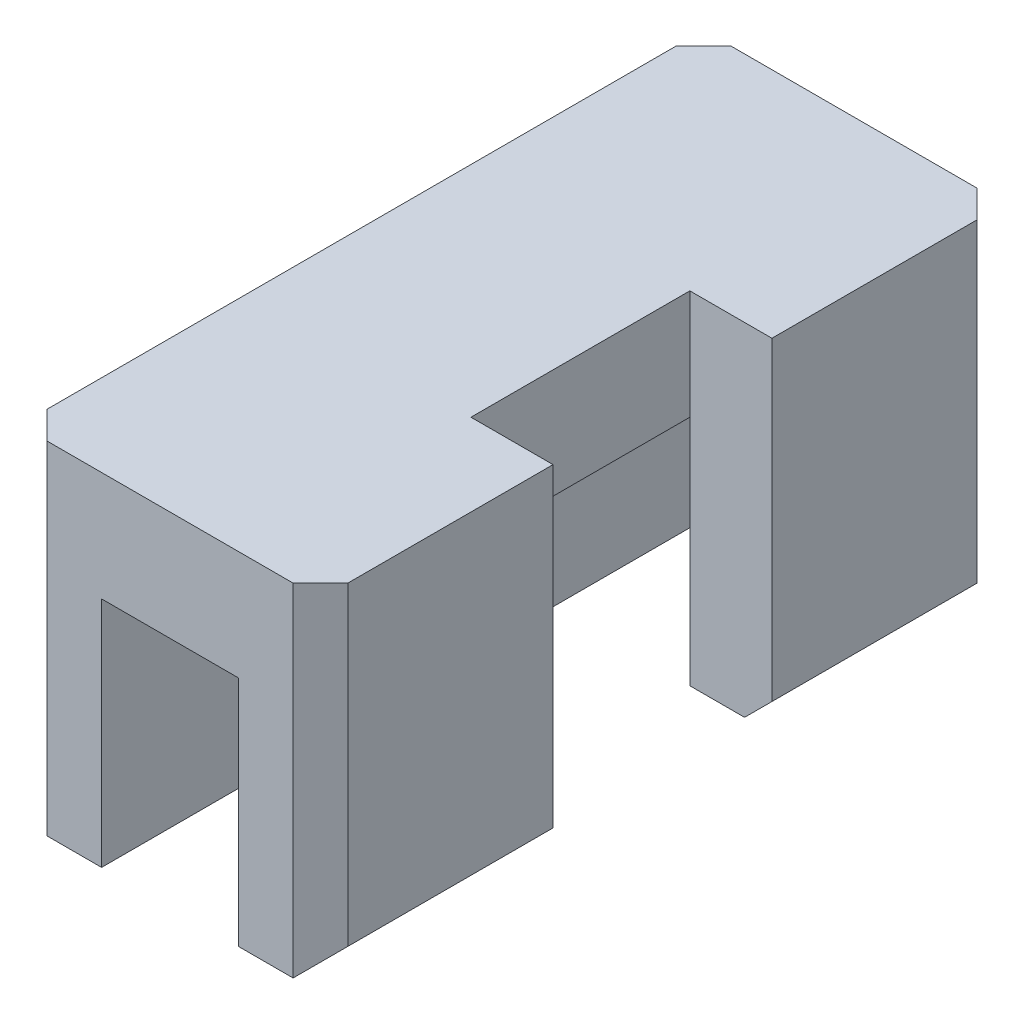
from build123d import *

# Parameters (mm, degrees)
ESTRUSIONE_ESTRUSIONE1_DEPTH = 50
SCHIZZO2_W                   = 16
SCHIZZO2_H                   = 25
TAGLIO_ESTRUSIONE1_DEPTH     = 6
SCHIZZO3_R                   = 2.25
TAGLIO_ESTRUSIONE2_DEPTH     = 10
SMUSSO1_SIZE                 = 2


with BuildPart() as part:
    # Schizzo1 → Estrusione-Estrusione1 (new body)
    with BuildSketch(Plane.XY):
        Polygon((5, 0), (-5, 0), (-5, -17), (-11, -17), (-11, 8), (11, 8), (11, -17), (5, -17), align=None)
    extrude(amount=ESTRUSIONE_ESTRUSIONE1_DEPTH)

    # Schizzo2 → Taglio-Estrusione1 (cut)
    with BuildSketch(Plane(origin=(11, 0, 0), x_dir=(0, 0, -1), z_dir=(1, 0, 0))):
        with Locations((-25, -4.5)):
            Rectangle(SCHIZZO2_W, SCHIZZO2_H)
    extrude(amount=-TAGLIO_ESTRUSIONE1_DEPTH, mode=Mode.SUBTRACT)

    # Schizzo3 → Taglio-Estrusione2 (cut)
    with BuildSketch(Plane(origin=(-5, 0, 0), x_dir=(0, 0, -1), z_dir=(1, 0, 0))):
        with Locations(Location((-25, -5.5, 0), (0, 0, 90))):
            Circle(SCHIZZO3_R)
    extrude(amount=-TAGLIO_ESTRUSIONE2_DEPTH, mode=Mode.SUBTRACT)

    # Smusso1
    smusso1_edges = [part.edges().sort_by_distance(p)[0] for p in [
        (11, -4.5, 0),
        (11, -4.5, 50),
        (-11, -17, 25),
        (11, -17, 41.5),
        (-11, -4.5, 50),
        (11, -17, 8.5),
        (-11, -4.5, 0),
    ]]
    chamfer(smusso1_edges, length=SMUSSO1_SIZE)


solid = part.part
